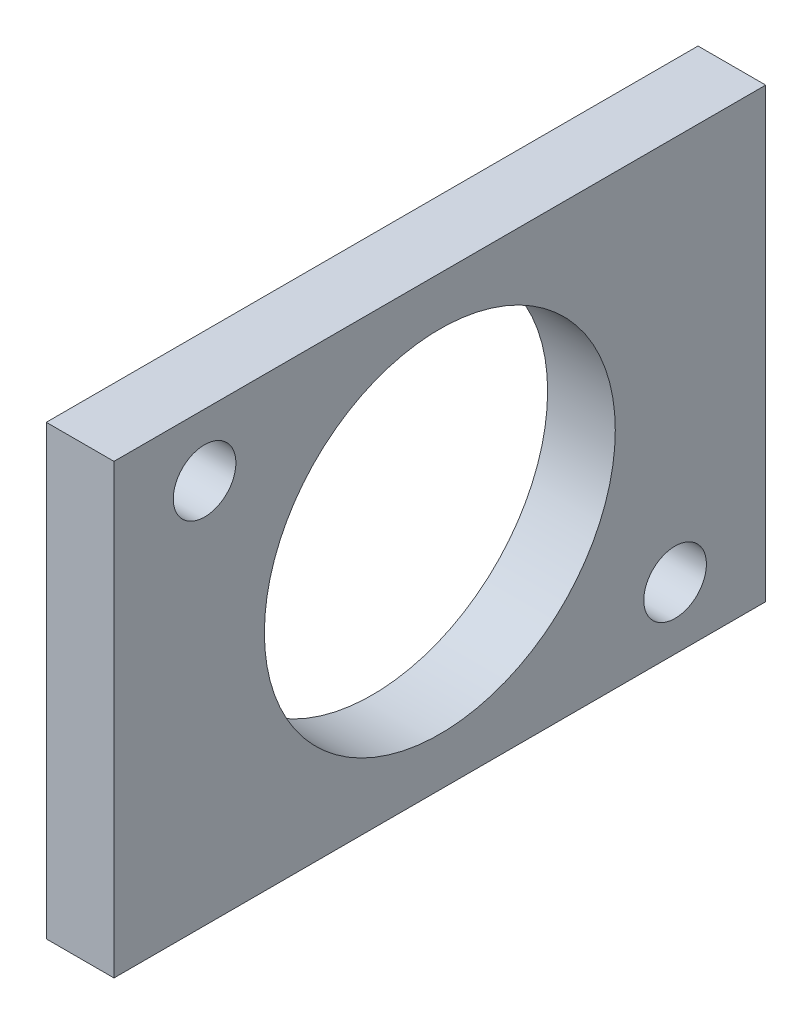
from build123d import *

# Parameters (mm, degrees)
CROQUIS2_W              = 52
CROQUIS2_H              = 35.7
SALIENTE_EXTRUIR1_DEPTH = 5.4
CROQUIS3_R              = 14
CROQUIS3_R_2            = 2.5
CORTAR_EXTRUIR2_DEPTH   = 5.4


with BuildPart() as part:
    # Croquis2 → Saliente-Extruir1 (new body)
    with BuildSketch(Plane(origin=(0, 0, 0), x_dir=(0, 0, -1), z_dir=(1, 0, 0))):
        Rectangle(CROQUIS2_W, CROQUIS2_H)
    extrude(amount=SALIENTE_EXTRUIR1_DEPTH)

    # Croquis3 → Cortar-Extruir2 (cut)
    with BuildSketch(Plane(origin=(5.4, 0, 0), x_dir=(0, 0, -1), z_dir=(1, 0, 0))):
        Circle(CROQUIS3_R)
        with Locations((-18.770882719, 12.886932943)):
            Circle(CROQUIS3_R_2)
        with Locations((18.770882719, -12.886932943)):
            Circle(CROQUIS3_R_2)
    extrude(amount=-CORTAR_EXTRUIR2_DEPTH, mode=Mode.SUBTRACT)


solid = part.part
